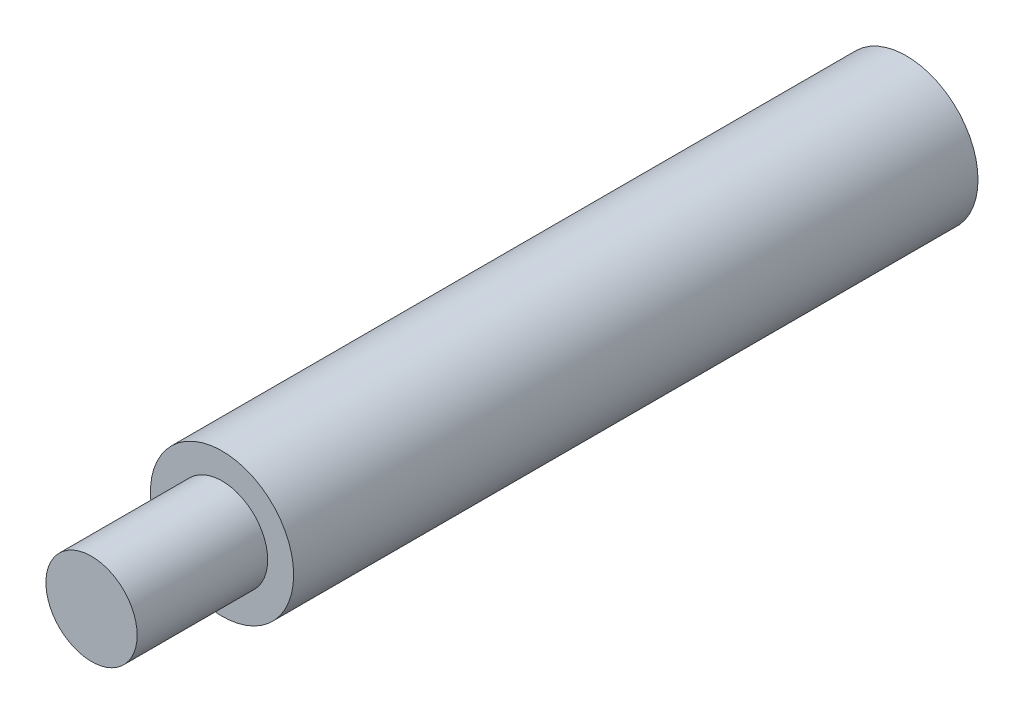
from build123d import *

# Parameters (mm, degrees)
SKETCH2_R           = 1
BOSS_EXTRUDE1_DEPTH = 17.86
SKETCH6_R           = 1.57
BOSS_EXTRUDE2_DEPTH = 15


with BuildPart() as part:
    # Sketch2 → Boss-Extrude1 (new body)
    with BuildSketch(Plane.XY):
        Circle(SKETCH2_R)
    extrude(amount=BOSS_EXTRUDE1_DEPTH)

    # Sketch6 → Boss-Extrude2 (add)
    with BuildSketch(Plane.XY):
        Circle(SKETCH6_R)
    extrude(amount=BOSS_EXTRUDE2_DEPTH)


solid = part.part
